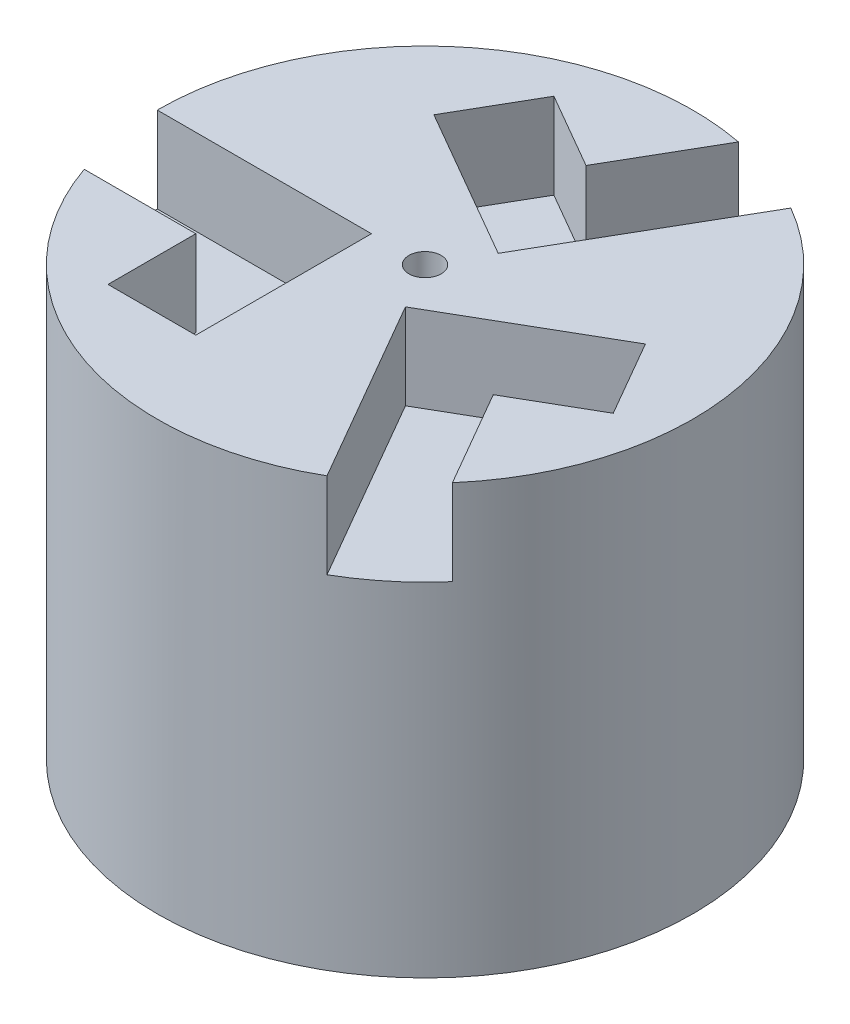
from build123d import *

# Parameters (mm, degrees)
SKETCH1_R           = 25
BOSS_EXTRUDE1_DEPTH = 40
CUT_EXTRUDE1_START  = -8
CUT_EXTRUDE1_DEPTH  = 8
CIRPATTERN1_COUNT   = 3
SKETCH7_R           = 15.1
CUT_EXTRUDE3_DEPTH  = 8.7
SKETCH8_R           = 1.5
CUT_EXTRUDE4_DEPTH  = 48.219593391


with BuildPart() as part:
    # Sketch1 → Boss-Extrude1 (new body)
    with BuildSketch(Plane(origin=(0, 0, 0), x_dir=(1, 0, 0), z_dir=(0, 1, 0))):
        with Locations(Location((0, 0, 0), (0, 0, 270))):
            Circle(SKETCH1_R)
    extrude(amount=BOSS_EXTRUDE1_DEPTH)

    # Sketch2 → Cut-Extrude1 (cut)
    with BuildSketch(Plane(origin=(0, 40, 0), x_dir=(1, 0, 0), z_dir=(0, 1, 0)).offset(CUT_EXTRUDE1_START)):
        with BuildLine():
            Line((-25, 0), (-5, 0))
            Line((-5, 0), (-5, -16.4))
            Line((-5, -16.4), (-13.2, -16.4))
            Line((-13.2, -16.4), (-13.2, -8.2))
            Line((-13.2, -8.2), (-23.616943071, -8.2))
            ThreePointArc((-23.616943071, -8.2), (-24.651811057, -4.157909525), (-25, 0))
        make_face()
    cut_extrude1 = extrude(amount=CUT_EXTRUDE1_DEPTH, mode=Mode.SUBTRACT)

    # CirPattern1: Cut-Extrude1 ×3 about axis
    cirpattern1_axis = Axis((0, 0, 0), (0, 1, 0))
    for i in range(1, CIRPATTERN1_COUNT):
        add(cut_extrude1.rotate(cirpattern1_axis, i * 360 / CIRPATTERN1_COUNT), mode=Mode.SUBTRACT)

    # Sketch7 → Cut-Extrude3 (cut)
    with BuildSketch(Plane.XZ):
        with Locations(Location((0, 0, 0), (0, 0, 270))):
            Circle(SKETCH7_R)
    extrude(amount=-CUT_EXTRUDE3_DEPTH, mode=Mode.SUBTRACT)

    # Sketch8 → Cut-Extrude4 (cut, through all)
    with BuildSketch(Plane.XZ.offset(-8.7)):
        with Locations(Location((0, 0, 0), (0, 0, 270))):
            Circle(SKETCH8_R)
    extrude(amount=-CUT_EXTRUDE4_DEPTH, mode=Mode.SUBTRACT)


solid = part.part
